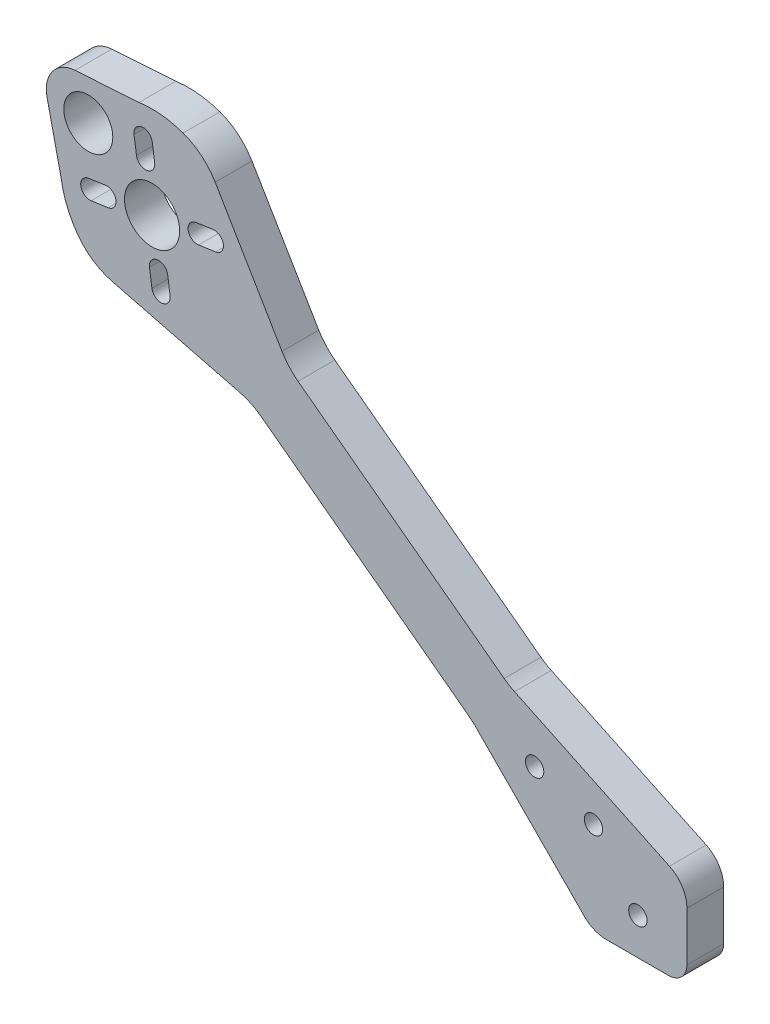
from build123d import *

# Parameters (mm, degrees)
CROQUIS1_R              = 1.5
CROQUIS1_R_2            = 4
CROQUIS1_R_3            = 4.5
SALIENTE_EXTRUIR1_DEPTH = 6


with BuildPart() as part:
    # Croquis1 → Saliente-Extruir1 (new body)
    with BuildSketch(Plane.XY):
        with BuildLine():
            Line((0, 3), (0, 11.005922656))
            ThreePointArc((0, 11.005922656), (-0.772770469, 13.676227974), (-2.852212196, 15.521120055))
            Line((-2.852212196, 15.521120055), (-28.127681877, 27.544148224))
            ThreePointArc((-28.127681877, 27.544148224), (-29.001474549, 28.014307534), (-29.824371512, 28.568747792))
            Line((-29.824371512, 28.568747792), (-63.171065255, 53.528446126))
            Line((-63.171065255, 53.528446126), (-63.451967787, 53.738699128))
            ThreePointArc((-63.451967787, 53.738699128), (-64.905667664, 55.069346162), (-66.070176318, 56.659246931))
            Line((-66.070176318, 56.659246931), (-76.965636536, 75.10772477))
            ThreePointArc((-76.965636536, 75.10772477), (-79.204988458, 77.730188181), (-82.201994916, 79.436049742))
            ThreePointArc((-82.201994916, 79.436049742), (-85.75594879, 80.239775378), (-89.398839068, 80.162876369))
            Line((-89.398839068, 80.162876369), (-99.846657066, 79.479321846))
            ThreePointArc((-99.846657066, 79.479321846), (-103.523124692, 77.4861215), (-104.39928334, 73.396915238))
            Line((-104.39928334, 73.396915238), (-102.110353231, 63.180020081))
            ThreePointArc((-102.110353231, 63.180020081), (-101.157367153, 59.663149232), (-99.384526804, 56.479817622))
            ThreePointArc((-99.384526804, 56.479817622), (-96.903104349, 54.085124746), (-93.75579069, 52.675717741))
            Line((-93.75579069, 52.675717741), (-72.984328521, 47.421790897))
            ThreePointArc((-72.984328521, 47.421790897), (-71.130664391, 46.752616664), (-69.44423303, 45.732903898))
            Line((-69.44423303, 45.732903898), (-35.612091664, 20.409852413))
            ThreePointArc((-35.612091664, 20.409852413), (-35.03729077, 19.945518736), (-34.498346176, 19.44000854))
            Line((-34.498346176, 19.44000854), (-16.717412791, 1.482024321))
            ThreePointArc((-16.717412791, 1.482024321), (-15.089260875, 0.385356005), (-13.164407425, 0))
            Line((-13.164407425, 0), (-3, 0))
            ThreePointArc((-3, 0), (-0.878679656, 0.878679656), (0, 3))
        make_face()
        with Locations((-24.85, 18.6)):
            Circle(CROQUIS1_R, mode=Mode.SUBTRACT)
        with Locations((-8, 6)):
            Circle(CROQUIS1_R, mode=Mode.SUBTRACT)
        with Locations((-97.670701805, 73.105635959)):
            Circle(CROQUIS1_R_2, mode=Mode.SUBTRACT)
        with Locations((-87.263168006, 65.315691143)):
            Circle(CROQUIS1_R_3, mode=Mode.SUBTRACT)
        with Locations((-15.25, 15.25)):
            Circle(CROQUIS1_R, mode=Mode.SUBTRACT)
        with BuildLine():
            Line((-87.237824709, 75.67483482), (-86.839166111, 72.903360245))
            ThreePointArc((-86.839166111, 72.903360245), (-88.110317527, 71.205074616), (-89.808603156, 72.476226032))
            Line((-89.808603156, 72.476226032), (-90.207261755, 75.247700608))
            ThreePointArc((-90.207261755, 75.247700608), (-88.936110338, 76.945986237), (-87.237824709, 75.67483482))
        make_face(mode=Mode.SUBTRACT)
        with BuildLine():
            Line((-76.904024329, 65.290347847), (-79.675498905, 64.891689248))
            ThreePointArc((-79.675498905, 64.891689248), (-81.373784533, 66.162840665), (-80.102633117, 67.861126294))
            Line((-80.102633117, 67.861126294), (-77.331158542, 68.259784892))
            ThreePointArc((-77.331158542, 68.259784892), (-75.632872913, 66.988633476), (-76.904024329, 65.290347847))
        make_face(mode=Mode.SUBTRACT)
        with BuildLine():
            Line((-87.288511303, 54.956547467), (-87.687169901, 57.728022042))
            ThreePointArc((-87.687169901, 57.728022042), (-86.416018485, 59.426307671), (-84.717732856, 58.155156254))
            Line((-84.717732856, 58.155156254), (-84.319074258, 55.383681679))
            ThreePointArc((-84.319074258, 55.383681679), (-85.590225674, 53.68539605), (-87.288511303, 54.956547467))
        make_face(mode=Mode.SUBTRACT)
        with BuildLine():
            Line((-97.622311683, 65.34103444), (-94.850837108, 65.739693038))
            ThreePointArc((-94.850837108, 65.739693038), (-93.152551479, 64.468541622), (-94.423702895, 62.770255993))
            Line((-94.423702895, 62.770255993), (-97.19517747, 62.371597395))
            ThreePointArc((-97.19517747, 62.371597395), (-98.893463099, 63.642748811), (-97.622311683, 65.34103444))
        make_face(mode=Mode.SUBTRACT)
    extrude(amount=SALIENTE_EXTRUIR1_DEPTH)


solid = part.part
